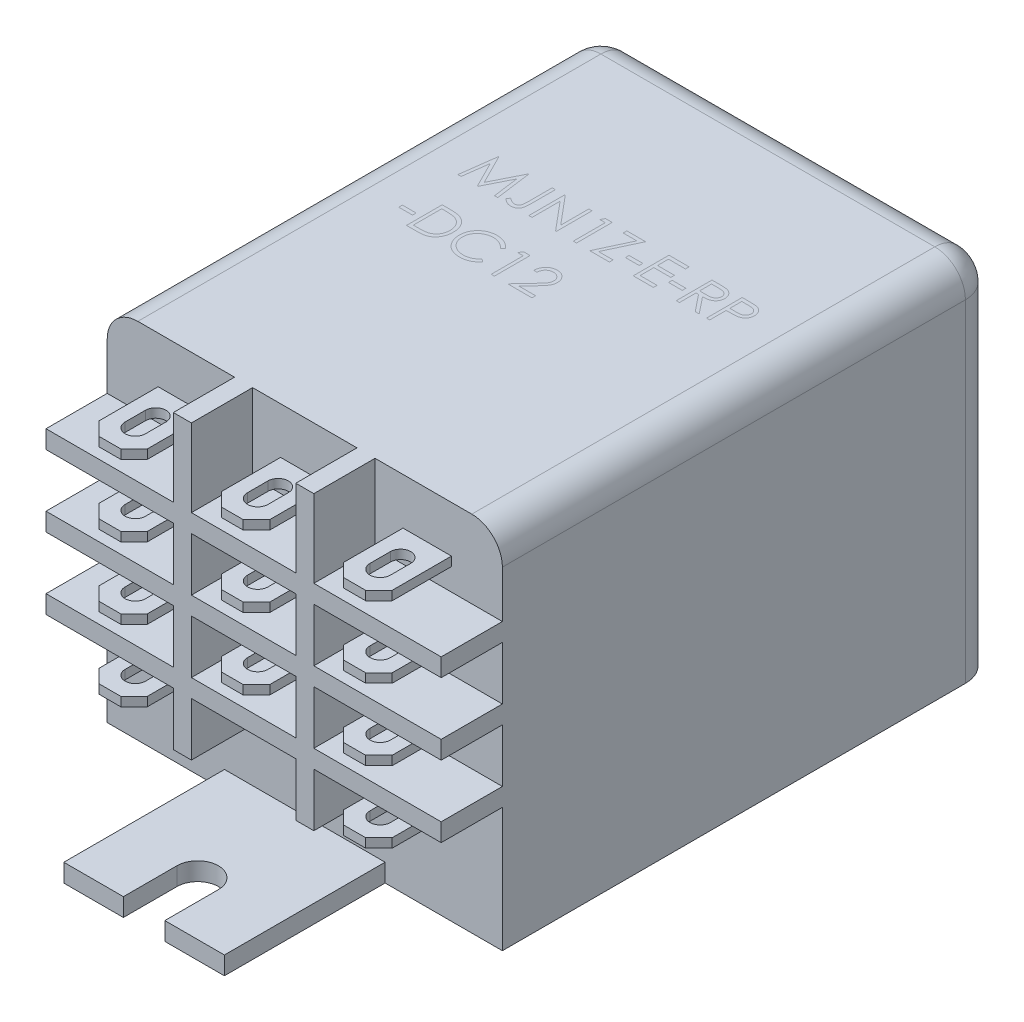
from build123d import *

# Parameters (mm, degrees)
SKETCH1_W              = 38.73
SKETCH1_H              = 48.38
BOSS_EXTRUDE1_DEPTH    = 35.56
BOSS_EXTRUDE2_DEPTH    = 1.77
SKETCH3_W              = 4.7498
SKETCH3_H              = 0.889
BOSS_EXTRUDE3_DEPTH    = 7.11
BOSS_EXTRUDE3_2_DEPTH  = 7.11
BOSS_EXTRUDE3_3_DEPTH  = 7.11
BOSS_EXTRUDE3_4_DEPTH  = 7.11
BOSS_EXTRUDE3_5_DEPTH  = 7.11
BOSS_EXTRUDE3_6_DEPTH  = 7.11
BOSS_EXTRUDE3_7_DEPTH  = 7.11
BOSS_EXTRUDE3_8_DEPTH  = 7.11
BOSS_EXTRUDE3_9_DEPTH  = 7.11
BOSS_EXTRUDE3_10_DEPTH = 7.11
BOSS_EXTRUDE3_11_DEPTH = 7.11
CUT_EXTRUDE1_DEPTH     = 26
SKETCH5_W              = 10.23
SKETCH5_H              = 5.23
BOSS_EXTRUDE4_DEPTH    = 6
FILLET1_R              = 6
FILLET2_R              = 3


with BuildPart() as part:
    # Sketch1 → Boss-Extrude1 (new body)
    with BuildSketch(Plane(origin=(0, 0, 0), x_dir=(1, 0, 0), z_dir=(0, 1, 0))):
        Rectangle(SKETCH1_W, SKETCH1_H)
    extrude(amount=BOSS_EXTRUDE1_DEPTH)

    # Sketch2 → Boss-Extrude2 (add)
    with BuildSketch(Plane(origin=(0, 0, 0), x_dir=(1, 0, 0), z_dir=(0, 1, 0))):
        with BuildLine():
            Line((-7.87, 24.19), (7.87, 24.19))
            Line((7.87, 24.19), (7.87, 33.72))
            Line((7.87, 33.72), (2.03, 33.72))
            Line((2.03, 33.72), (2.03, 28.81))
            ThreePointArc((2.03, 28.81), (0, 26.78), (-2.03, 28.81))
            Line((-2.03, 28.81), (-2.03, 33.72))
            Line((-2.03, 33.72), (-7.87, 33.72))
            Line((-7.87, 33.72), (-7.87, 24.19))
        make_face()
        with BuildLine():
            Line((7.87, -24.19), (-7.87, -24.19))
            Line((-7.87, -24.19), (-7.87, -39.94))
            Line((-7.87, -39.94), (-2.03, -39.94))
            Line((-2.03, -39.94), (-2.03, -34.69))
            ThreePointArc((-2.03, -34.69), (0, -32.66), (2.03, -34.69))
            Line((2.03, -34.69), (2.03, -39.94))
            Line((2.03, -39.94), (7.87, -39.94))
            Line((7.87, -39.94), (7.87, -24.19))
        make_face()
    extrude(amount=BOSS_EXTRUDE2_DEPTH)

    # Sketch5 → Boss-Extrude4 (add)
    with BuildSketch(Plane.XY.offset(24.19)):
        Polygon((-19.365, 27.945), (-6.885, 27.945), (-6.885, 35.56), (-5.115, 35.56), (-5.115, 27.945), (5.115, 27.945), (5.115, 35.56), (6.885, 35.56), (6.885, 27.945), (19.365, 27.945), (19.365, 26.175), (6.885, 26.175), (6.885, 20.945), (19.365, 20.945), (19.365, 19.175), (6.885, 19.175), (6.885, 13.945), (19.365, 13.945), (19.365, 12.175), (6.885, 12.175), (6.885, 6.945), (5.115, 6.945), (5.115, 12.175), (-5.115, 12.175), (-5.115, 6.945), (-6.885, 6.945), (-6.885, 12.175), (-19.365, 12.175), (-19.365, 13.945), (-6.885, 13.945), (-6.885, 19.175), (-19.365, 19.175), (-19.365, 20.945), (-6.885, 20.945), (-6.885, 26.175), (-19.365, 26.175), align=None)
        with Locations((0, 23.56)):
            Rectangle(SKETCH5_W, SKETCH5_H, mode=Mode.SUBTRACT)
        with Locations((0, 16.56)):
            Rectangle(SKETCH5_W, SKETCH5_H, mode=Mode.SUBTRACT)
    extrude(amount=BOSS_EXTRUDE4_DEPTH)

    # Fillet1
    fillet1_edges = [part.edges().sort_by_distance(p)[0] for p in [
        (-7.87, 0.885, -24.19),
        (7.87, 0.885, -24.19),
    ]]
    fillet(fillet1_edges, radius=FILLET1_R)

    # Fillet2
    fillet2_edges = [part.edges().sort_by_distance(p)[0] for p in [
        (19.365, 35.56, 0),
        (0, 35.56, -24.19),
        (-19.365, 35.56, 0),
        (-19.365, 17.78, -24.19),
        (19.365, 17.78, -24.19),
    ]]
    fillet(fillet2_edges, radius=FILLET2_R)


with BuildPart() as body_2:
    # Sketch3 → Boss-Extrude3 (new body)
    with BuildSketch(Plane.XY.offset(24.19)):
        with Locations((0, 30.56)):
            Rectangle(SKETCH3_W, SKETCH3_H)
    extrude(amount=BOSS_EXTRUDE3_DEPTH)


with BuildPart() as body_3:
    # Sketch3 → Boss-Extrude3 2 (new body)
    with BuildSketch(Plane.XY.offset(24.19)):
        with Locations((12, 30.56)):
            Rectangle(SKETCH3_W, SKETCH3_H)
    extrude(amount=BOSS_EXTRUDE3_2_DEPTH)


with BuildPart() as body_4:
    # Sketch3 → Boss-Extrude3 3 (new body)
    with BuildSketch(Plane.XY.offset(24.19)):
        with Locations((12, 23.56)):
            Rectangle(SKETCH3_W, SKETCH3_H)
    extrude(amount=BOSS_EXTRUDE3_3_DEPTH)


with BuildPart() as body_5:
    # Sketch3 → Boss-Extrude3 4 (new body)
    with BuildSketch(Plane.XY.offset(24.19)):
        with Locations((12, 16.56)):
            Rectangle(SKETCH3_W, SKETCH3_H)
    extrude(amount=BOSS_EXTRUDE3_4_DEPTH)


with BuildPart() as body_6:
    # Sketch3 → Boss-Extrude3 5 (new body)
    with BuildSketch(Plane.XY.offset(24.19)):
        with Locations((12, 9.56)):
            Rectangle(SKETCH3_W, SKETCH3_H)
    extrude(amount=BOSS_EXTRUDE3_5_DEPTH)


with BuildPart() as body_7:
    # Sketch3 → Boss-Extrude3 6 (new body)
    with BuildSketch(Plane.XY.offset(24.19)):
        with Locations((0, 23.56)):
            Rectangle(SKETCH3_W, SKETCH3_H)
    extrude(amount=BOSS_EXTRUDE3_6_DEPTH)


with BuildPart() as body_8:
    # Sketch3 → Boss-Extrude3 7 (new body)
    with BuildSketch(Plane.XY.offset(24.19)):
        with Locations((0, 16.56)):
            Rectangle(SKETCH3_W, SKETCH3_H)
    extrude(amount=BOSS_EXTRUDE3_7_DEPTH)


with BuildPart() as body_9:
    # Sketch3 → Boss-Extrude3 8 (new body)
    with BuildSketch(Plane.XY.offset(24.19)):
        with Locations((-12, 30.56)):
            Rectangle(SKETCH3_W, SKETCH3_H)
    extrude(amount=BOSS_EXTRUDE3_8_DEPTH)


with BuildPart() as body_10:
    # Sketch3 → Boss-Extrude3 9 (new body)
    with BuildSketch(Plane.XY.offset(24.19)):
        with Locations((-12, 23.56)):
            Rectangle(SKETCH3_W, SKETCH3_H)
    extrude(amount=BOSS_EXTRUDE3_9_DEPTH)


with BuildPart() as body_11:
    # Sketch3 → Boss-Extrude3 10 (new body)
    with BuildSketch(Plane.XY.offset(24.19)):
        with Locations((-12, 16.56)):
            Rectangle(SKETCH3_W, SKETCH3_H)
    extrude(amount=BOSS_EXTRUDE3_10_DEPTH)


with BuildPart() as body_12:
    # Sketch3 → Boss-Extrude3 11 (new body)
    with BuildSketch(Plane.XY.offset(24.19)):
        with Locations((-12, 9.56)):
            Rectangle(SKETCH3_W, SKETCH3_H)
    extrude(amount=BOSS_EXTRUDE3_11_DEPTH)


with BuildPart() as cut_extrude1_tool:
    # Sketch4 → Cut-Extrude1 (new body)
    with BuildSketch(Plane(origin=(0, 31.0045, 0), x_dir=(1, 0, 0), z_dir=(0, 1, 0))):
        Polygon((-14.8749, -29.5), (-12.5749, -31.8), (-11.4251, -31.8), (-9.1251, -29.5), (-9.1251, -32.8), (-14.8749, -32.8), align=None)
        with BuildLine():
            Line((-11, -26.8), (-11, -28.8))
            ThreePointArc((-11, -28.8), (-12, -29.8), (-13, -28.8))
            Line((-13, -28.8), (-13, -26.8))
            ThreePointArc((-13, -26.8), (-12, -25.8), (-11, -26.8))
        make_face()
        Polygon((-2.8749, -32.8), (-2.8749, -29.5), (-0.5749, -31.8), (0.5749, -31.8), (2.8749, -29.5), (2.8749, -32.8), align=None)
        with BuildLine():
            Line((1, -26.8), (1, -28.8))
            ThreePointArc((1, -28.8), (0, -29.8), (-1, -28.8))
            Line((-1, -28.8), (-1, -26.8))
            ThreePointArc((-1, -26.8), (0, -25.8), (1, -26.8))
        make_face()
        Polygon((9.1251, -32.8), (9.1251, -29.5), (11.4251, -31.8), (12.5749, -31.8), (14.8749, -29.5), (14.8749, -32.8), align=None)
        with BuildLine():
            Line((13, -26.8), (13, -28.8))
            ThreePointArc((13, -28.8), (12, -29.8), (11, -28.8))
            Line((11, -28.8), (11, -26.8))
            ThreePointArc((11, -26.8), (12, -25.8), (13, -26.8))
        make_face()
    extrude(amount=-CUT_EXTRUDE1_DEPTH)


with BuildPart() as body_2_1:
    add(body_2.part)

    # Cut-Extrude1: cut by cut_extrude1_tool
    add(cut_extrude1_tool.part, mode=Mode.SUBTRACT)


with BuildPart() as body_3_1:
    add(body_3.part)

    # Cut-Extrude1: cut by cut_extrude1_tool
    add(cut_extrude1_tool.part, mode=Mode.SUBTRACT)


with BuildPart() as body_4_1:
    add(body_4.part)

    # Cut-Extrude1: cut by cut_extrude1_tool
    add(cut_extrude1_tool.part, mode=Mode.SUBTRACT)


with BuildPart() as body_5_1:
    add(body_5.part)

    # Cut-Extrude1: cut by cut_extrude1_tool
    add(cut_extrude1_tool.part, mode=Mode.SUBTRACT)


with BuildPart() as body_6_1:
    add(body_6.part)

    # Cut-Extrude1: cut by cut_extrude1_tool
    add(cut_extrude1_tool.part, mode=Mode.SUBTRACT)


with BuildPart() as body_7_1:
    add(body_7.part)

    # Cut-Extrude1: cut by cut_extrude1_tool
    add(cut_extrude1_tool.part, mode=Mode.SUBTRACT)


with BuildPart() as body_8_1:
    add(body_8.part)

    # Cut-Extrude1: cut by cut_extrude1_tool
    add(cut_extrude1_tool.part, mode=Mode.SUBTRACT)


with BuildPart() as body_9_1:
    add(body_9.part)

    # Cut-Extrude1: cut by cut_extrude1_tool
    add(cut_extrude1_tool.part, mode=Mode.SUBTRACT)


with BuildPart() as body_10_1:
    add(body_10.part)

    # Cut-Extrude1: cut by cut_extrude1_tool
    add(cut_extrude1_tool.part, mode=Mode.SUBTRACT)


with BuildPart() as body_11_1:
    add(body_11.part)

    # Cut-Extrude1: cut by cut_extrude1_tool
    add(cut_extrude1_tool.part, mode=Mode.SUBTRACT)


with BuildPart() as body_12_1:
    add(body_12.part)

    # Cut-Extrude1: cut by cut_extrude1_tool
    add(cut_extrude1_tool.part, mode=Mode.SUBTRACT)


solid = Compound([part.part, body_2_1.part, body_3_1.part, body_4_1.part, body_5_1.part, body_6_1.part, body_7_1.part, body_8_1.part, body_9_1.part, body_10_1.part, body_11_1.part, body_12_1.part])
